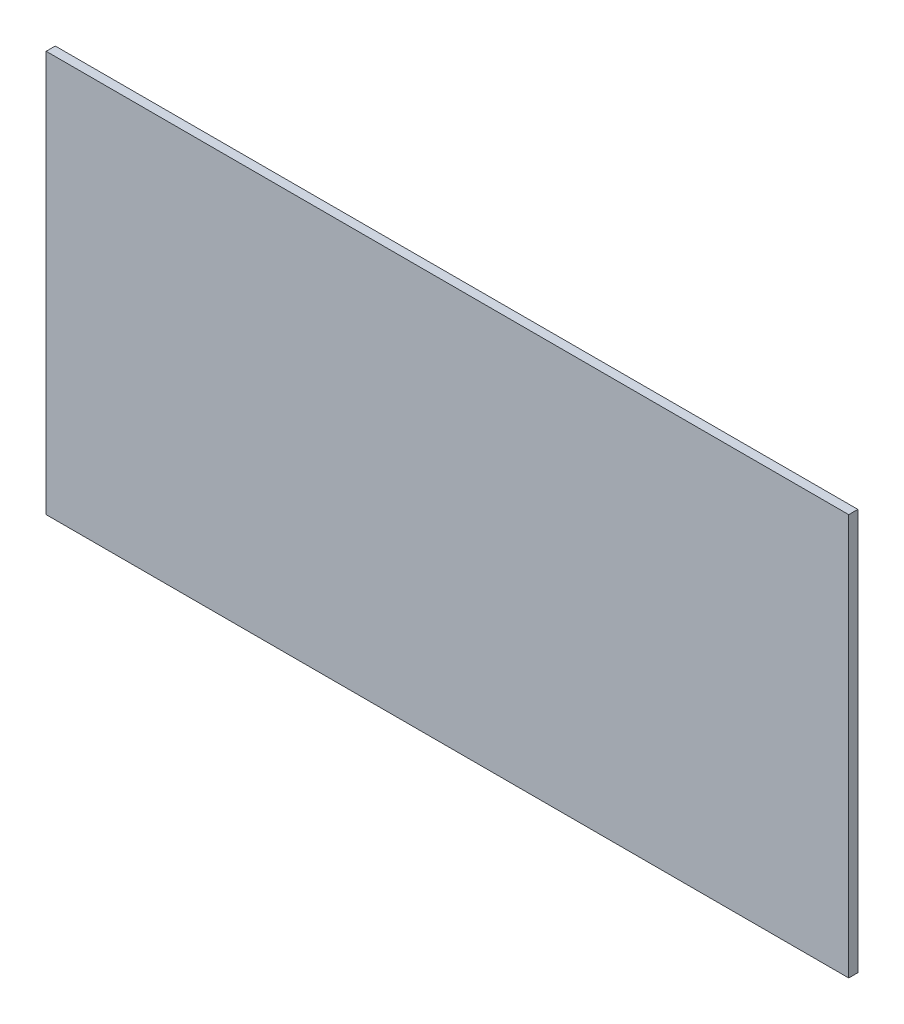
from build123d import *

# Parameters (mm, degrees)
ESQUISSE1_W        = 440
ESQUISSE1_H        = 220
BOSS_EXTRU_3_DEPTH = 5


with BuildPart() as part:
    # Esquisse1 → Boss.-Extru.3 (new body)
    with BuildSketch(Plane.XY):
        Rectangle(ESQUISSE1_W, ESQUISSE1_H)
    extrude(amount=BOSS_EXTRU_3_DEPTH)


solid = part.part
